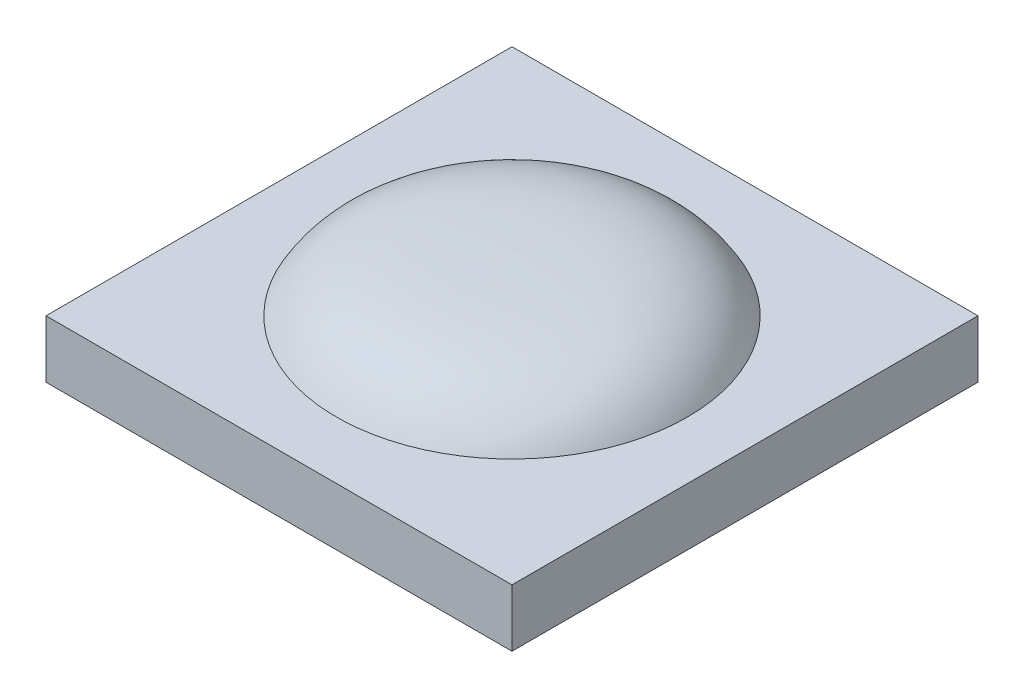
from build123d import *

# Parameters (mm, degrees)
SKETCH2_W           = 81
SKETCH2_H           = 81
BOSS_EXTRUDE1_DEPTH = 10


with BuildPart() as part:
    # Sketch1 → Revolve1 (revolve)
    with BuildSketch(Plane.XY):
        with BuildLine():
            Line((0, 10), (0, 0))
            Line((0, 0), (30.5, 0))
            add(Edge.make_bspline(
                [(30.5, 0), (24.462439427, 10.588096747), (11.157200838, 9.492825223), (0, 10)],
                knots=[0, 0, 0, 0, 1, 1, 1, 1], degree=3))
        make_face()
    revolve(axis=Axis((0, 10, 0), (0, -1, 0)))

    # Sketch2 → Boss-Extrude1 (add)
    with BuildSketch(Plane(origin=(0, 0, 0), x_dir=(1, 0, 0), z_dir=(0, 1, 0))):
        Rectangle(SKETCH2_W, SKETCH2_H)
    extrude(amount=-BOSS_EXTRUDE1_DEPTH)


solid = part.part
